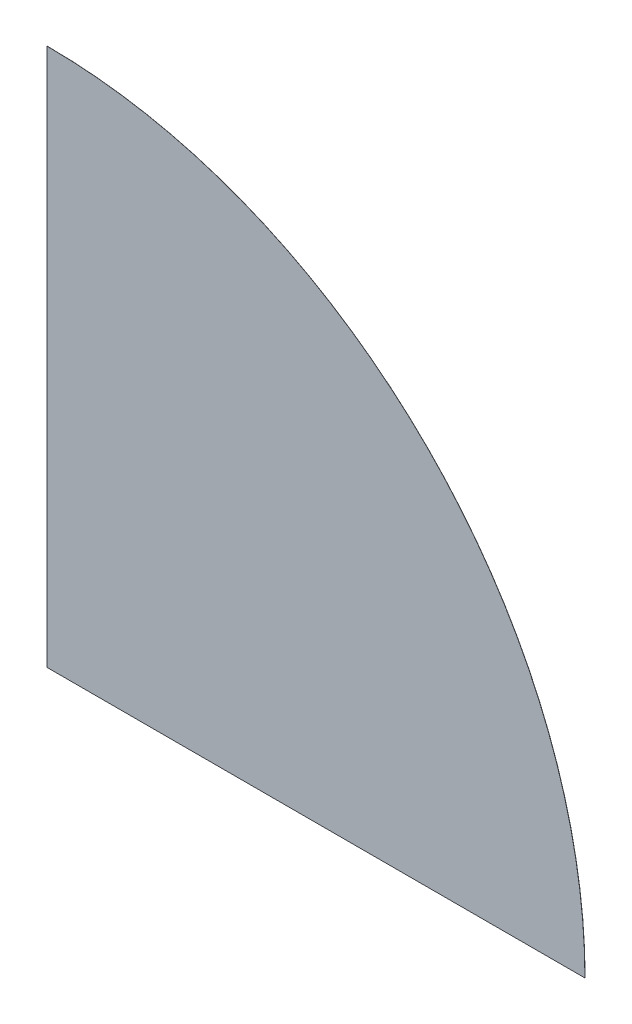
from build123d import *

# Parameters (mm, degrees)
BOSS_EXTRUDE1_DEPTH = 0.001


with BuildPart() as part:
    # Sketch1 → Boss-Extrude1 (new body)
    with BuildSketch(Plane.XY):
        with BuildLine():
            Line((0, 0), (3.57, 0))
            ThreePointArc((3.57, 0), (2.524371209, 2.524371209), (0, 3.57))
            Line((0, 3.57), (0, 0))
        make_face()
    extrude(amount=BOSS_EXTRUDE1_DEPTH)


solid = part.part
